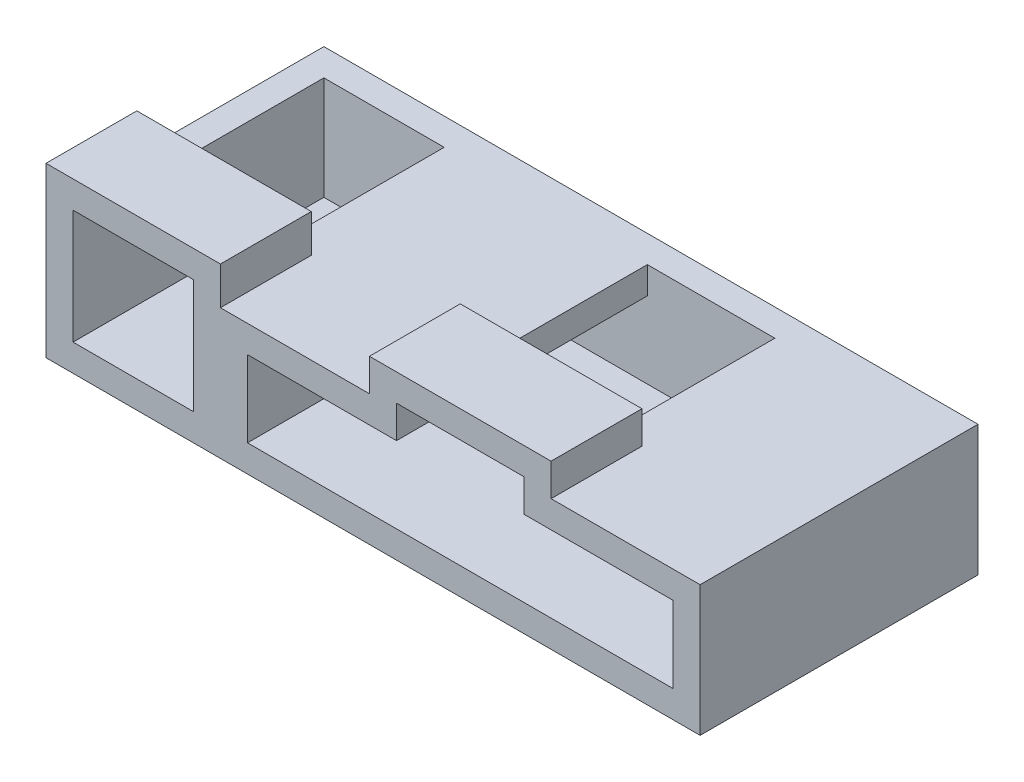
from build123d import *

# Parameters (mm, degrees)
SKETCH1_W               = 27.6225
SKETCH1_H               = 11.7348
BOSS_EXTRUDE1_DEPTH     = 7.112
CUT_EXTRUDE1_DEPTH      = 46.755458387
CUT_EXTRUDE1_DEPTH_BACK = 46.755458387
SKETCH3_W               = 5.08
SKETCH3_H               = 4.826
CUT_EXTRUDE2_DEPTH      = 10.5918
CUT_EXTRUDE3_REACH      = 56.598
SKETCH4_W               = 21.32965
SKETCH4_H               = 7.8994


with BuildPart() as part:
    # Sketch1 → Boss-Extrude1 (new body)
    with BuildSketch(Plane(origin=(0, 0, 0), x_dir=(1, 0, 0), z_dir=(0, 1, 0))):
        with Locations((-29.838216172, 26.150202934)):
            Rectangle(SKETCH1_W, SKETCH1_H)
    extrude(amount=BOSS_EXTRUDE1_DEPTH)

    # Sketch2 → Cut-Extrude1 (cut, two sides: drawn at the far end of the back side and taken through both)
    with BuildSketch(Plane.XY.offset(-20.282802934).offset(-CUT_EXTRUDE1_DEPTH_BACK)):
        Polygon((-36.283466172, 73.446090762), (-36.283466172, 7.112), (-36.283466172, 5.5118), (-29.990616172, 5.5118), (-29.990616172, 6.8834), (-22.319816172, 6.8834), (-22.319816172, 5.5118), (-16.026966172, 5.5118), (50.307124589, 5.5118), (132.196959284, 109.890444188), (45.606368522, 177.82473495), align=None)
    extrude(amount=CUT_EXTRUDE1_DEPTH + CUT_EXTRUDE1_DEPTH_BACK, mode=Mode.SUBTRACT)

    # Sketch3 → Cut-Extrude2 (cut)
    with BuildSketch(Plane.XY.offset(-20.282802934)):
        with Locations((-39.966466172, 3.556)):
            Rectangle(SKETCH3_W, SKETCH3_H)
        Polygon((-35.140466172, 4.3688), (-35.140466172, 1.143), (-17.169966172, 1.143), (-17.169966172, 4.3688), (-23.462816172, 4.3688), (-23.462816172, 5.7404), (-28.847616172, 5.7404), (-28.847616172, 4.3688), align=None)
    extrude(amount=-CUT_EXTRUDE2_DEPTH, mode=Mode.SUBTRACT)

    # Cut-Extrude3: up to this face of the body (flat: up to its plane)
    cut_extrude3_end = Plane(part.part.faces().sort_by_distance((-33.137041172, 5.5118, -26.150202934))[0])
    # Sketch4 → Cut-Extrude3 (cut, up to the picked face)
    with BuildSketch(Plane(origin=(0, 7.112, 0), x_dir=(1, 0, 0), z_dir=(0, 1, 0)), mode=Mode.PRIVATE) as cut_extrude3_sk1:
        with Locations((-32.984641172, 28.067902934)):
            Rectangle(SKETCH4_W, SKETCH4_H)
    cut_extrude3_tool1 = split(extrude(cut_extrude3_sk1.sketch, amount=-CUT_EXTRUDE3_REACH, mode=Mode.PRIVATE), bisect_by=cut_extrude3_end, keep=Keep.BOTH, mode=Mode.PRIVATE)
    add(cut_extrude3_tool1.solids().sort_by(Axis((-32.984641, 7.112, -28.067903), (0, -1, 0)))[0], mode=Mode.SUBTRACT)


solid = part.part
